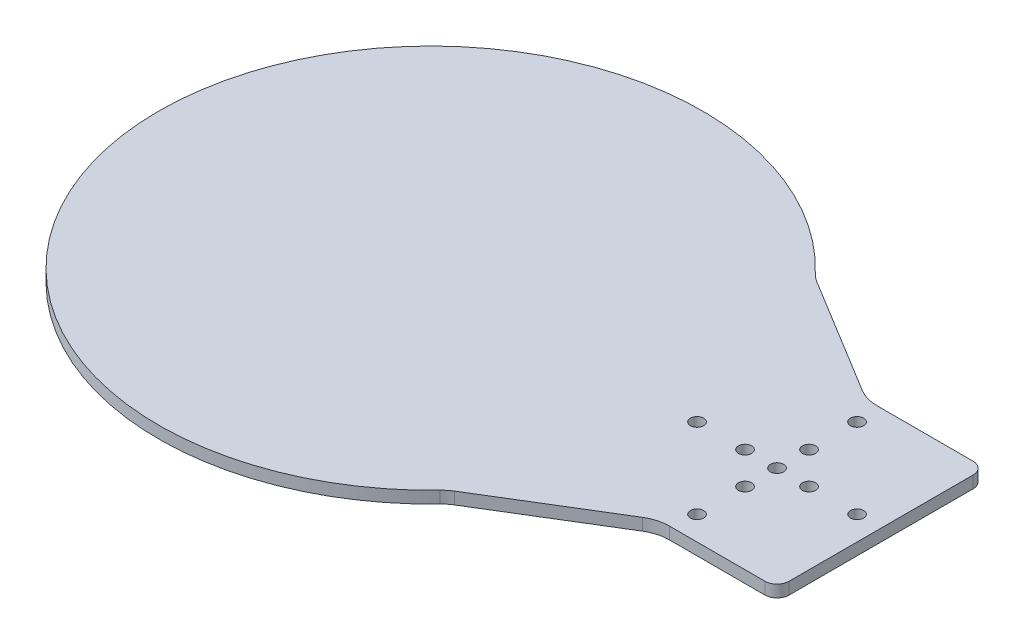
from build123d import *

# Parameters (mm, degrees)
SKETCH1_R           = 1.65
BOSS_EXTRUDE1_DEPTH = 3
BOSS_EXTRUDE2_START = -3
BOSS_EXTRUDE2_DEPTH = 3
FILLET1_R           = 10
FILLET2_R           = 3


with BuildPart() as part:
    # Sketch1 → Boss-Extrude1 (new body)
    with BuildSketch(Plane(origin=(0, 0, 0), x_dir=(1, 0, 0), z_dir=(0, 1, 0))):
        with BuildLine():
            Line((62.83311229, -26), (112.579, -26))
            Line((112.579, -26), (112.579, 26))
            Line((112.579, 26), (62.83311229, 26))
            ThreePointArc((62.83311229, 26), (-68, 0), (62.83311229, -26))
        make_face()
        with Locations(Location((86.579, 0, 0), (0, 0, 270))):
            Circle(SKETCH1_R, mode=Mode.SUBTRACT)
        with Locations(Location((94.579, 0, 0), (0, 0, 270))):
            Circle(SKETCH1_R, mode=Mode.SUBTRACT)
        with Locations(Location((106.579, 0, 0), (0, 0, 270))):
            Circle(SKETCH1_R, mode=Mode.SUBTRACT)
        with Locations(Location((86.579, -8, 0), (0, 0, 270))):
            Circle(SKETCH1_R, mode=Mode.SUBTRACT)
        with Locations(Location((86.579, -20, 0), (0, 0, 270))):
            Circle(SKETCH1_R, mode=Mode.SUBTRACT)
        with Locations(Location((78.579, 0, 0), (0, 0, 270))):
            Circle(SKETCH1_R, mode=Mode.SUBTRACT)
        with Locations(Location((66.579, 0, 0), (0, 0, 270))):
            Circle(SKETCH1_R, mode=Mode.SUBTRACT)
        with Locations(Location((86.579, 8, 0), (0, 0, 270))):
            Circle(SKETCH1_R, mode=Mode.SUBTRACT)
        with Locations(Location((86.579, 20, 0), (0, 0, 270))):
            Circle(SKETCH1_R, mode=Mode.SUBTRACT)
    extrude(amount=BOSS_EXTRUDE1_DEPTH)

    # Sketch2 → Boss-Extrude2 (add)
    with BuildSketch(Plane(origin=(0, 3, 0), x_dir=(1, 0, 0), z_dir=(0, 1, 0)).offset(BOSS_EXTRUDE2_START)):
        with BuildLine():
            ThreePointArc((62.83311229, -26), (57.335321786, -36.560373025), (50.079936102, -46))
            Line((50.079936102, -46), (82.83311229, -26))
            Line((82.83311229, -26), (62.83311229, -26))
        make_face()
        with BuildLine():
            Line((62.83311229, 26), (82.83311229, 26))
            Line((82.83311229, 26), (50.079936102, 46))
            ThreePointArc((50.079936102, 46), (57.335321786, 36.560373025), (62.83311229, 26))
        make_face()
    extrude(amount=BOSS_EXTRUDE2_DEPTH)

    # Fillet1
    fillet1_edges = [part.edges().sort_by_distance(p)[0] for p in [
        (50.079936102, 1.5, 46),
        (82.83311229, 1.5, 26),
        (50.079936102, 1.5, -46),
        (82.83311229, 1.5, -26),
    ]]
    fillet(fillet1_edges, radius=FILLET1_R)

    # Fillet2
    fillet2_edges = [part.edges().sort_by_distance(p)[0] for p in [
        (112.579, 1.5, -26),
        (112.579, 1.5, 26),
    ]]
    fillet(fillet2_edges, radius=FILLET2_R)


solid = part.part
